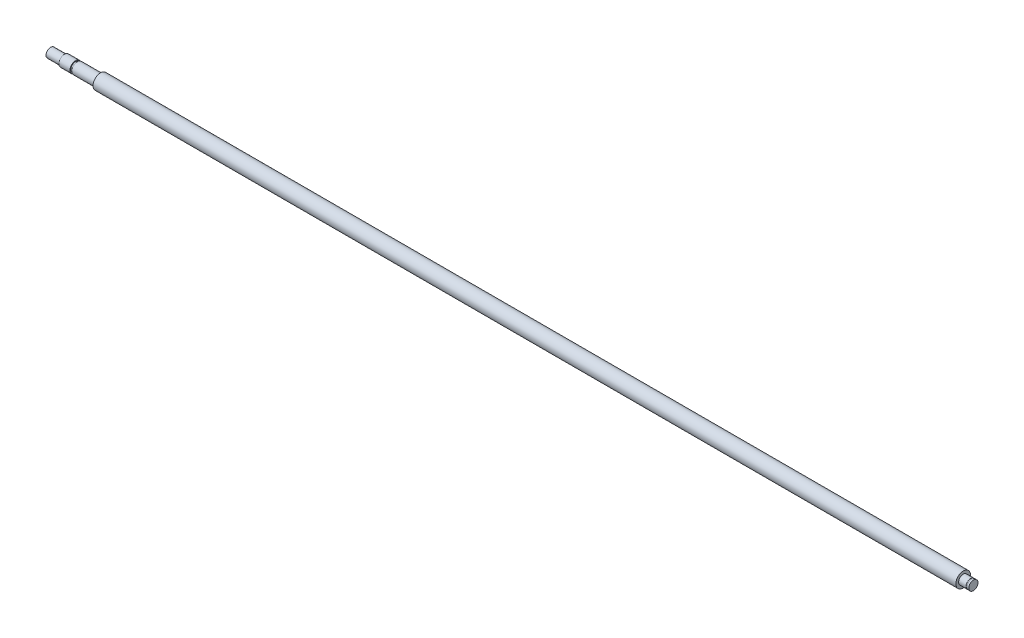
from build123d import *


with BuildPart() as part:
    # Sketch1 → Revolve1 (revolve)
    with BuildSketch(Plane.XY, mode=Mode.PRIVATE) as revolve1_sk:
        Polygon((-54, 0), (946, 0), (946, 5), (944.15, 5), (944.15, 4.8), (943, 4.8), (943, 5), (935, 5), (935, 8), (0, 8), (0, 6), (-25, 6), (-25, 5), (-27, 5), (-27, 6), (-39, 6), (-39, 5), (-54, 5), align=None)
    revolve(revolve1_sk.sketch.rotate(Axis((-54, 0, 0), (1, 0, 0)), 90), axis=Axis((-54, 0, 0), (1, 0, 0)))


solid = part.part
